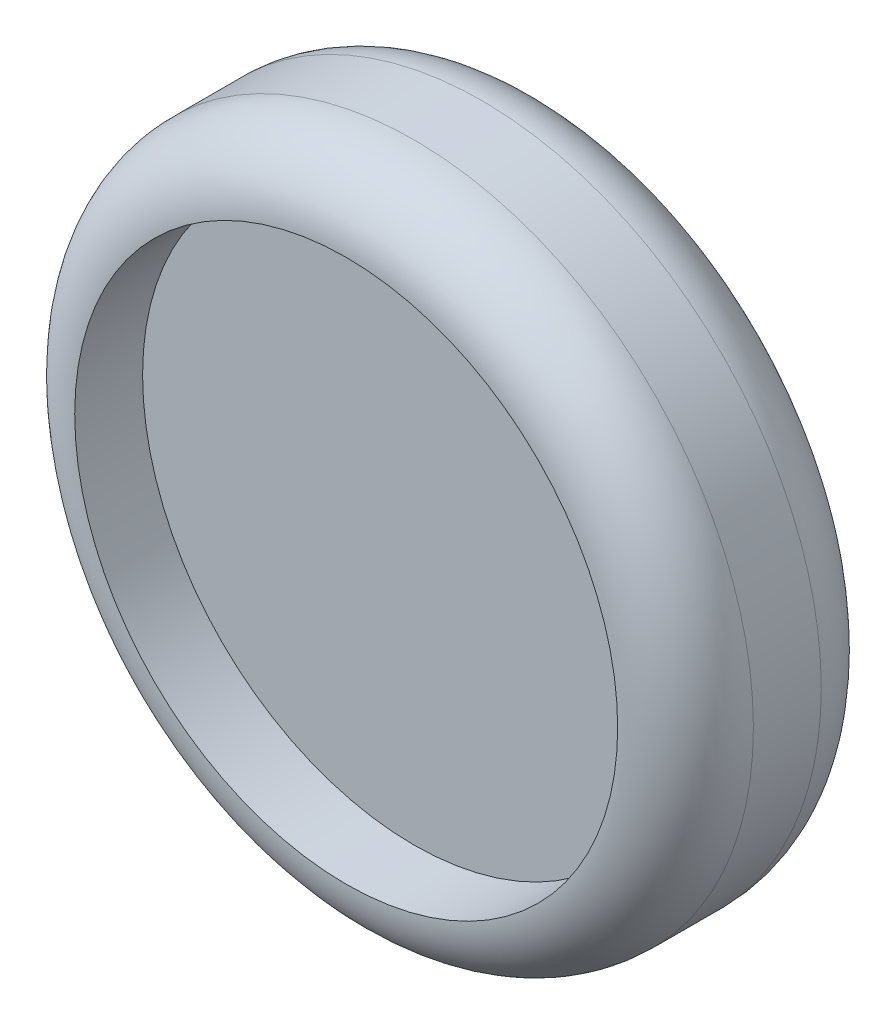
from build123d import *

# Parameters (mm, degrees)
SKETCH1_R           = 50
BOSS_EXTRUDE1_DEPTH = 30
FILLET1_R           = 10
SKETCH2_R           = 40
CUT_EXTRUDE1_DEPTH  = 10
CUT_EXTRUDE2_START  = -10
SKETCH3_R           = 40
CUT_EXTRUDE2_DEPTH  = 10
SCALE1_SCALE        = 2


with BuildPart() as part:
    # Sketch1 → Boss-Extrude1 (new body)
    with BuildSketch(Plane.XY):
        Circle(SKETCH1_R)
    extrude(amount=BOSS_EXTRUDE1_DEPTH)

    # Fillet1
    fillet1_edges = [part.edges().sort_by_distance(p)[0] for p in [
        (-50, 0, 0),
        (-50, 0, 30),
    ]]
    fillet(fillet1_edges, radius=FILLET1_R)

    # Sketch2 → Cut-Extrude1 (cut)
    with BuildSketch(Plane.XY.offset(30)):
        Circle(SKETCH2_R)
    extrude(amount=-CUT_EXTRUDE1_DEPTH, mode=Mode.SUBTRACT)

    # Sketch3 → Cut-Extrude2 (cut)
    with BuildSketch(Plane(origin=(0, 0, 0), x_dir=(-1, 0, 0), z_dir=(0, 0, -1)).offset(CUT_EXTRUDE2_START)):
        with Locations(Location((0, 0, 0), (0, 0, 180))):
            Circle(SKETCH3_R)
    extrude(amount=CUT_EXTRUDE2_DEPTH, mode=Mode.SUBTRACT)


with BuildPart() as part_1:
    # Scale1: scaled about (0, 0, 15)
    add(part.part.scale(SCALE1_SCALE).moved(Location((0, 0, -15))))


solid = part_1.part
